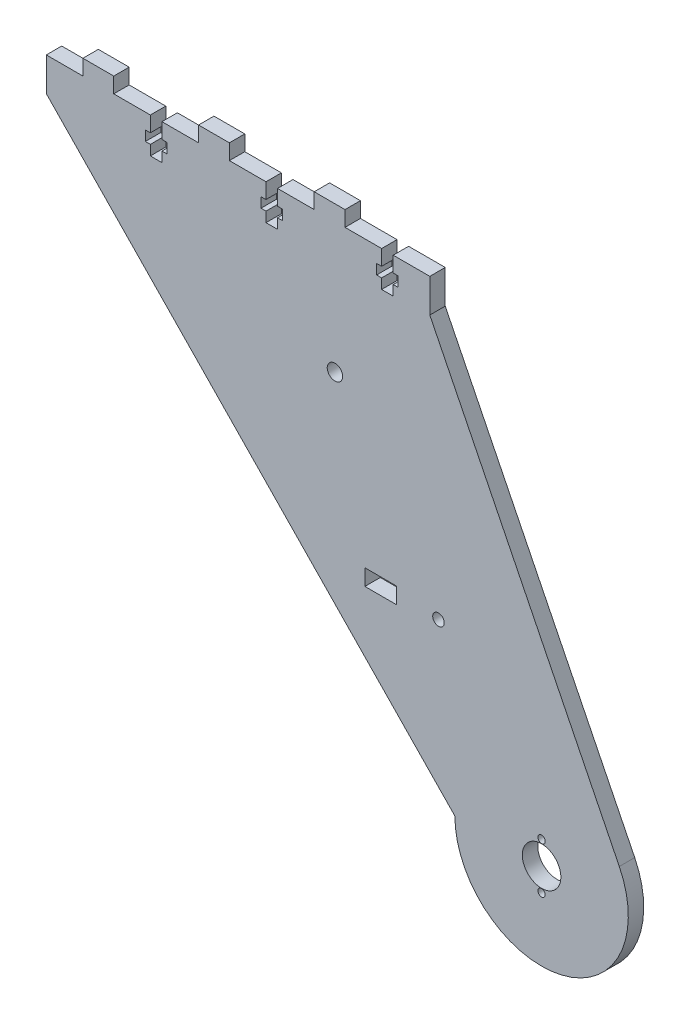
from build123d import *

# Parameters (mm, degrees)
SKETCH_1_R      = 2
SKETCH_1_R_2    = 1.5
SKETCH_1_R_3    = 5
SKETCH_1_R_4    = 0.95
SKETCH_1_W      = 8.2
SKETCH_1_H      = 4.2
EXTRUDE_1_DEPTH = 4


with BuildPart() as part:
    # 草图1 → 凸台-拉伸1 (new body)
    with BuildSketch(Plane.XY):
        with BuildLine():
            Line((-38.15, 66.25), (-38.15, 62.25))
            Line((-38.15, 62.25), (-39.45, 62.25))
            Line((-39.45, 62.25), (-39.45, 59.65))
            Line((-39.45, 59.65), (-38.15, 59.65))
            Line((-38.15, 59.65), (-38.15, 57.05))
            Line((-38.15, 57.05), (-35.15, 57.05))
            Line((-35.15, 57.05), (-35.15, 59.65))
            Line((-35.15, 59.65), (-33.85, 59.65))
            Line((-33.85, 59.65), (-33.85, 62.25))
            Line((-33.85, 62.25), (-35.15, 62.25))
            Line((-35.15, 62.25), (-35.15, 66.25))
            Line((-35.15, 66.25), (-25.65, 66.25))
            Line((-25.65, 66.25), (-25.65, 70.25))
            Line((-25.65, 70.25), (-17.65, 70.25))
            Line((-17.65, 70.25), (-17.65, 66.25))
            Line((-17.65, 66.25), (-8.15, 66.25))
            Line((-8.15, 66.25), (-8.15, 62.25))
            Line((-8.15, 62.25), (-9.45, 62.25))
            Line((-9.45, 62.25), (-9.45, 59.65))
            Line((-9.45, 59.65), (-8.15, 59.65))
            Line((-8.15, 59.65), (-8.15, 57.05))
            Line((-8.15, 57.05), (-5.15, 57.05))
            Line((-5.15, 57.05), (-5.15, 59.65))
            Line((-5.15, 59.65), (-3.85, 59.65))
            Line((-3.85, 59.65), (-3.85, 62.25))
            Line((-3.85, 62.25), (-5.15, 62.25))
            Line((-5.15, 62.25), (-5.15, 66.25))
            Line((-5.15, 66.25), (4.35, 66.25))
            Line((4.35, 66.25), (4.35, 57.55))
            Line((4.35, 57.55), (53.51460577, -41.768082641))
            ThreePointArc((53.51460577, -41.768082641), (38.475737517, -73.658373169), (10.85, -51.75))
            Line((10.85, -51.75), (-95.15, 57.55))
            Line((-95.15, 57.55), (-95.15, 66.25))
            Line((-95.15, 66.25), (-85.65, 66.25))
            Line((-85.65, 66.25), (-85.65, 70.25))
            Line((-85.65, 70.25), (-77.65, 70.25))
            Line((-77.65, 70.25), (-77.65, 66.25))
            Line((-77.65, 66.25), (-68.15, 66.25))
            Line((-68.15, 66.25), (-68.15, 62.25))
            Line((-68.15, 62.25), (-69.45, 62.25))
            Line((-69.45, 62.25), (-69.45, 59.65))
            Line((-69.45, 59.65), (-68.15, 59.65))
            Line((-68.15, 59.65), (-68.15, 57.05))
            Line((-68.15, 57.05), (-65.15, 57.05))
            Line((-65.15, 57.05), (-65.15, 59.65))
            Line((-65.15, 59.65), (-63.85, 59.65))
            Line((-63.85, 59.65), (-63.85, 62.25))
            Line((-63.85, 62.25), (-65.15, 62.25))
            Line((-65.15, 62.25), (-65.15, 66.25))
            Line((-65.15, 66.25), (-55.65, 66.25))
            Line((-55.65, 66.25), (-55.65, 70.25))
            Line((-55.65, 70.25), (-47.65, 70.25))
            Line((-47.65, 70.25), (-47.65, 66.25))
            Line((-47.65, 66.25), (-38.15, 66.25))
        make_face()
        with Locations((-20.262745434, 32.422010331)):
            Circle(SKETCH_1_R, mode=Mode.SUBTRACT)
        with Locations((6.598407643, -9.75)):
            Circle(SKETCH_1_R_2, mode=Mode.SUBTRACT)
        with Locations((33.35, -51.75)):
            Circle(SKETCH_1_R_3, mode=Mode.SUBTRACT)
        with Locations((33.35, -45.75)):
            Circle(SKETCH_1_R_4, mode=Mode.SUBTRACT)
        with Locations((33.35, -57.75)):
            Circle(SKETCH_1_R_4, mode=Mode.SUBTRACT)
        with Locations((-8.401592357, -9.75)):
            Rectangle(SKETCH_1_W, SKETCH_1_H, mode=Mode.SUBTRACT)
    extrude(amount=EXTRUDE_1_DEPTH)


solid = part.part
